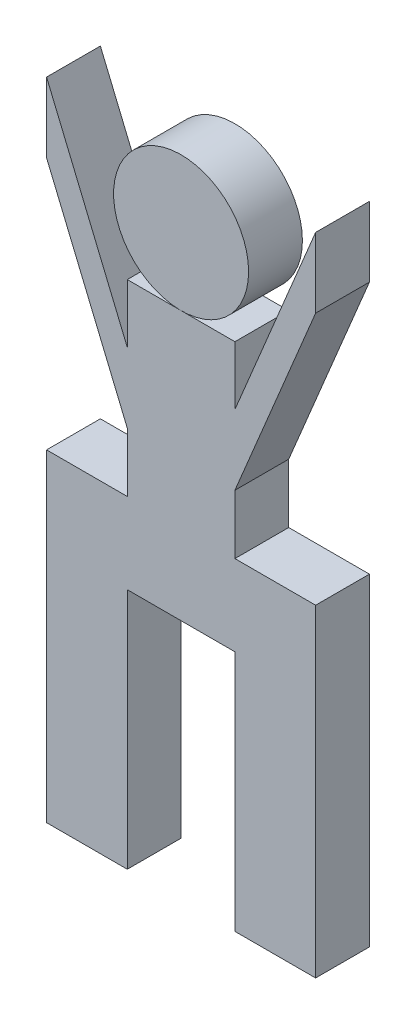
from build123d import *

# Parameters (mm, degrees)
SKETCH_1_R      = 12.544634771
SKETCH_1_W      = 20
SKETCH_1_H      = 15
EXTRUDE_1_DEPTH = 10


with BuildPart() as part:
    # 스케치1 → 보스-돌출1 (new body)
    with BuildSketch(Plane.XY):
        with Locations((0, 47.455365229)):
            Circle(SKETCH_1_R)
        Polygon((-10, 11), (-10, 0), (10, 0), (10, 11), (25, 47), (25, 60), (10, 24), (10, 34.910730459), (0, 34.910730459), (-10, 34.910730459), (-10, 24), (-25, 60), (-25, 47), align=None)
        Polygon((-10, 0), (-25, 0), (-25, -60), (-10, -60), (-10, -34.910730459), (-10, -15), align=None)
        with Locations((0, -7.5)):
            Rectangle(SKETCH_1_W, SKETCH_1_H)
        Polygon((25, 0), (10, 0), (10, -15), (10, -34.910730459), (10, -60), (25, -60), align=None)
    extrude(amount=EXTRUDE_1_DEPTH)


solid = part.part
